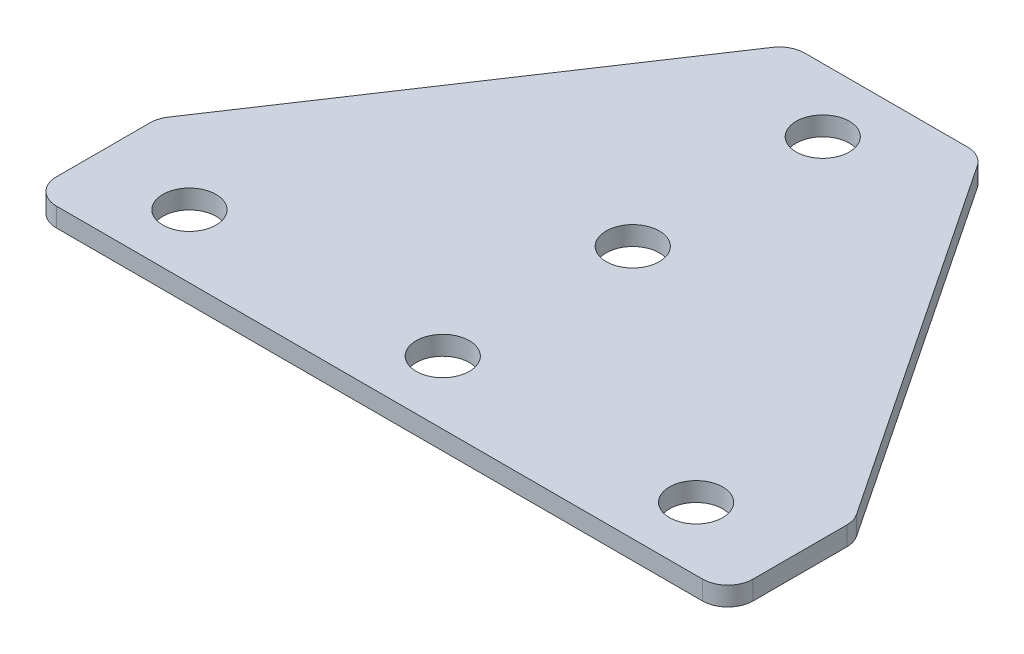
from build123d import *

# Parameters (mm, degrees)
SKETCH_1_R      = 2.1
EXTRUDE_1_DEPTH = 1.5
FILLET_1_R      = 2


with BuildPart() as part:
    # ｽｹｯﾁ1 → ﾎﾞｽ - 押し出し1 (new body)
    with BuildSketch(Plane(origin=(0, 0, 0), x_dir=(1, 0, 0), z_dir=(0, 1, 0))):
        Polygon((0, 0), (55, 0), (55, 10), (35, 40), (20, 40), (0, 10), align=None)
        with Locations(Location((7.5, 5, 0), (0, 0, 270))):
            Circle(SKETCH_1_R, mode=Mode.SUBTRACT)
        with Locations(Location((47.5, 5, 0), (0, 0, 90))):
            Circle(SKETCH_1_R, mode=Mode.SUBTRACT)
        with Locations(Location((27.5, 5, 0), (0, 0, 270))):
            Circle(SKETCH_1_R, mode=Mode.SUBTRACT)
        with Locations(Location((27.5, 35, 0), (0, 0, 270))):
            Circle(SKETCH_1_R, mode=Mode.SUBTRACT)
        with Locations(Location((27.5, 20, 0), (0, 0, 270))):
            Circle(SKETCH_1_R, mode=Mode.SUBTRACT)
    extrude(amount=EXTRUDE_1_DEPTH)

    # ﾌｨﾚｯﾄ1
    fillet_1_edges = [part.edges().sort_by_distance(p)[0] for p in [
        (0, 0.75, -10),
        (20, 0.75, -40),
        (35, 0.75, -40),
        (55, 0.75, -10),
        (55, 0.75, 0),
        (0, 0.75, 0),
    ]]
    fillet(fillet_1_edges, radius=FILLET_1_R)


solid = part.part
